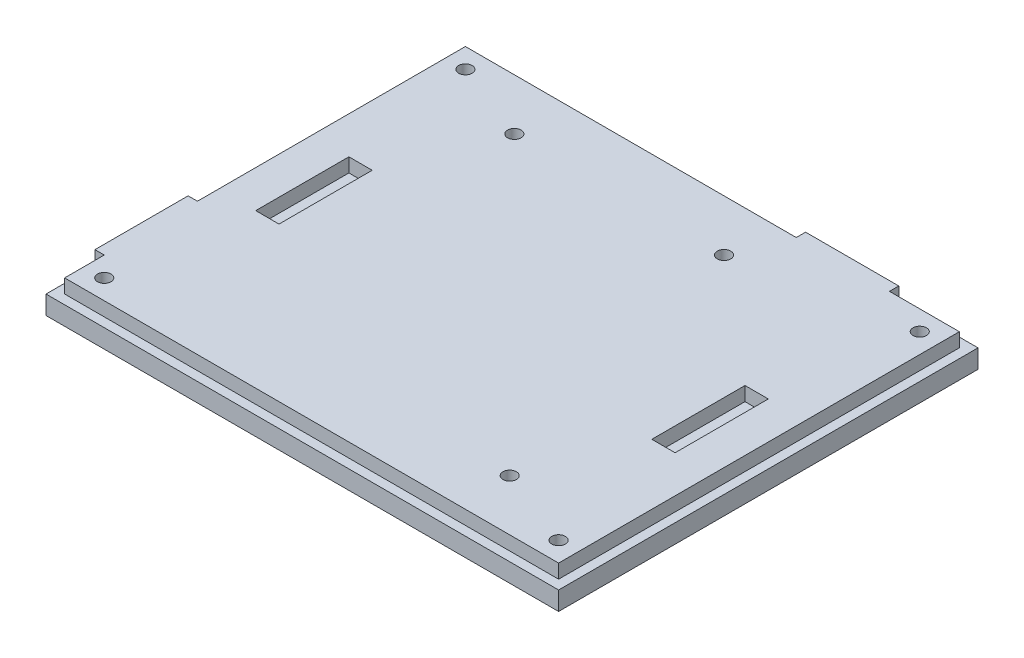
from build123d import *

# Parameters (mm, degrees)
SKETCH1_W                  = 110
SKETCH1_H                  = 90
BOSS_EXTRUDE1_DEPTH        = 7
M2_5_CLEARANCE_HOLE1_D     = 2.9
M2_5_CLEARANCE_HOLE1_DEPTH = 5
M2_5_CLEARANCE_HOLE1_TIP   = 0.871247898
SKETCH8_W                  = 5
SKETCH8_H                  = 20
CUT_EXTRUDE5_DEPTH         = 3
SKETCH10_W                 = 2
SKETCH10_H                 = 59.5
SKETCH10_H_2               = 10.5
CUT_EXTRUDE6_DEPTH         = 3
SKETCH11_W                 = 71
SKETCH11_H                 = 2
SKETCH11_W_2               = 17
CUT_EXTRUDE7_DEPTH         = 3
SKETCH12_W                 = 2
SKETCH12_H                 = 88
CUT_EXTRUDE8_DEPTH         = 3
SKETCH13_W                 = 106
SKETCH13_H                 = 2
CUT_EXTRUDE9_DEPTH         = 3
M2_5_CLEARANCE_HOLE2_D     = 2.9


with BuildPart() as part:
    # Sketch1 → Boss-Extrude1 (new body)
    with BuildSketch(Plane(origin=(0, 0, 0), x_dir=(1, 0, 0), z_dir=(0, 1, 0))):
        Rectangle(SKETCH1_W, SKETCH1_H)
    extrude(amount=BOSS_EXTRUDE1_DEPTH)

    # M2.5 Clearance Hole1
    with Locations(Plane(origin=(0, 7, 0), x_dir=(1, 0, 0), z_dir=(0, 1, 0))):
        with Locations((-31.5, 32), (13.5, 32), (31.5, -32)):
            Hole(M2_5_CLEARANCE_HOLE1_D / 2, depth=M2_5_CLEARANCE_HOLE1_DEPTH)
            with Locations((0, 0, -(M2_5_CLEARANCE_HOLE1_DEPTH + M2_5_CLEARANCE_HOLE1_TIP / 2))):  # 118° drill point
                Cone(0, M2_5_CLEARANCE_HOLE1_D / 2, M2_5_CLEARANCE_HOLE1_TIP, mode=Mode.SUBTRACT)

    # Sketch8 → Cut-Extrude5 (cut)
    with BuildSketch(Plane(origin=(0, 7, 0), x_dir=(1, 0, 0), z_dir=(0, 1, 0))):
        with Locations((-42.5, 0)):
            Rectangle(SKETCH8_W, SKETCH8_H)
        with Locations((42.5, 0)):
            Rectangle(SKETCH8_W, SKETCH8_H)
    extrude(amount=-CUT_EXTRUDE5_DEPTH, mode=Mode.SUBTRACT)

    # Sketch10 → Cut-Extrude6 (cut)
    with BuildSketch(Plane(origin=(0, 7, 0), x_dir=(1, 0, 0), z_dir=(0, 1, 0))):
        with Locations((-54, 15.25)):
            Rectangle(SKETCH10_W, SKETCH10_H)
        with Locations((-54, -39.75)):
            Rectangle(SKETCH10_W, SKETCH10_H_2)
    extrude(amount=-CUT_EXTRUDE6_DEPTH, mode=Mode.SUBTRACT)

    # Sketch11 → Cut-Extrude7 (cut)
    with BuildSketch(Plane(origin=(0, 7, 0), x_dir=(1, 0, 0), z_dir=(0, 1, 0))):
        with Locations((-17.5, 44)):
            Rectangle(SKETCH11_W, SKETCH11_H)
        with Locations((46.5, 44)):
            Rectangle(SKETCH11_W_2, SKETCH11_H)
    extrude(amount=-CUT_EXTRUDE7_DEPTH, mode=Mode.SUBTRACT)

    # Sketch12 → Cut-Extrude8 (cut)
    with BuildSketch(Plane(origin=(0, 7, 0), x_dir=(1, 0, 0), z_dir=(0, 1, 0))):
        with Locations((54, -1)):
            Rectangle(SKETCH12_W, SKETCH12_H)
    extrude(amount=-CUT_EXTRUDE8_DEPTH, mode=Mode.SUBTRACT)

    # Sketch13 → Cut-Extrude9 (cut)
    with BuildSketch(Plane(origin=(0, 7, 0), x_dir=(1, 0, 0), z_dir=(0, 1, 0))):
        with Locations((0, -44)):
            Rectangle(SKETCH13_W, SKETCH13_H)
    extrude(amount=-CUT_EXTRUDE9_DEPTH, mode=Mode.SUBTRACT)

    # M2.5 Clearance Hole2 (through all)
    with Locations(Plane(origin=(0, 7, 0), x_dir=(1, 0, 0), z_dir=(0, 1, 0))):
        with Locations((48.75, 38.75), (-48.75, 38.75), (48.75, -38.75), (-48.75, -38.75)):
            Hole(M2_5_CLEARANCE_HOLE2_D / 2)


solid = part.part
